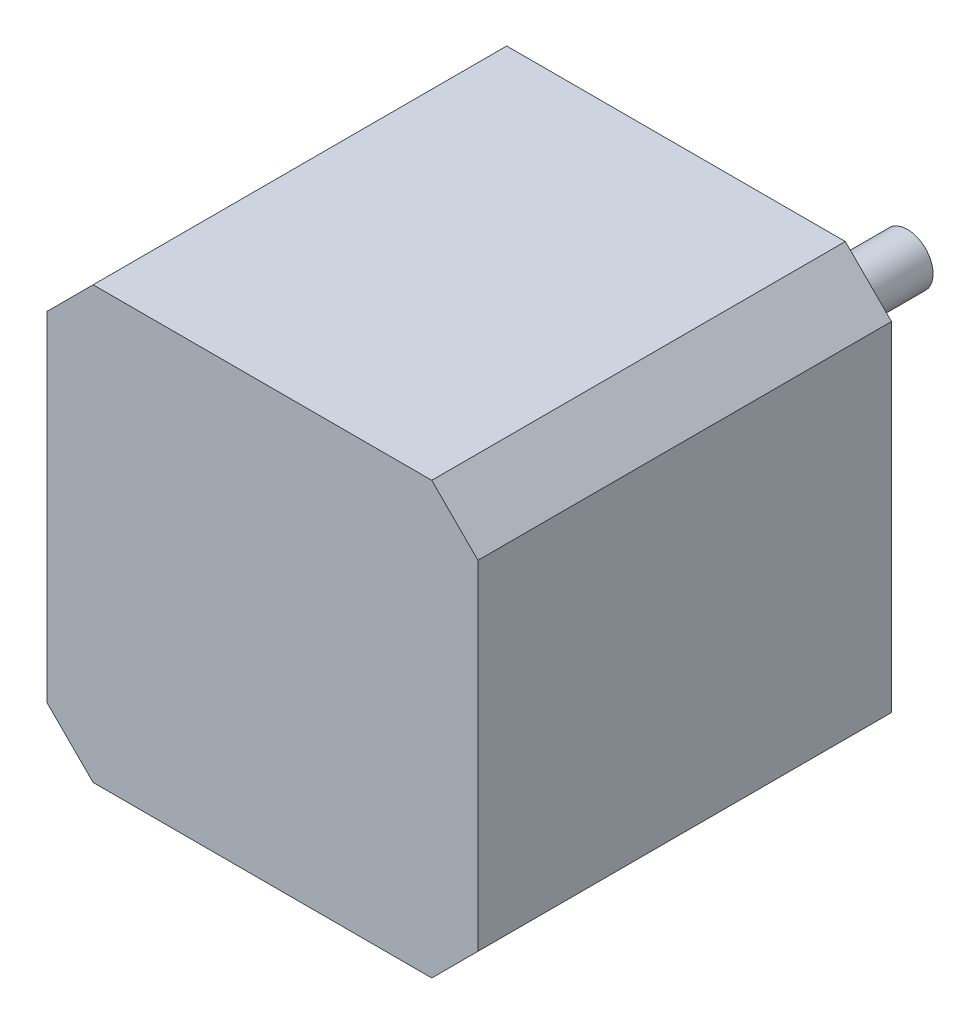
from build123d import *

# Parameters (mm, degrees)
SKETCH1_W           = 42
SKETCH1_H           = 42
BOSS_EXTRUDE1_DEPTH = 40.3
SKETCH1_3_R         = 1.5
CUT_EXTRUDE1_DEPTH  = 5
SKETCH1_4_R         = 11
BOSS_EXTRUDE2_DEPTH = 1.8
CHAMFER1_SIZE       = 4.5
SKETCH2_R           = 2.5
BOSS_EXTRUDE3_DEPTH = 20.75


with BuildPart() as part:
    # Sketch1 → Boss-Extrude1 (new body)
    with BuildSketch(Plane.XY):
        Rectangle(SKETCH1_W, SKETCH1_H)
    extrude(amount=BOSS_EXTRUDE1_DEPTH)

    # Sketch1<3> → Cut-Extrude1 (cut)
    with BuildSketch(Plane.XY):
        with Locations((15.5, 15.5)):
            Circle(SKETCH1_3_R)
        with Locations((15.5, -15.5)):
            Circle(SKETCH1_3_R)
        with Locations((-15.5, -15.5)):
            Circle(SKETCH1_3_R)
        with Locations((-15.5, 15.5)):
            Circle(SKETCH1_3_R)
    extrude(amount=CUT_EXTRUDE1_DEPTH, mode=Mode.SUBTRACT)

    # Sketch1<4> → Boss-Extrude2 (add)
    with BuildSketch(Plane.XY):
        Circle(SKETCH1_4_R)
    extrude(amount=-BOSS_EXTRUDE2_DEPTH)

    # Chamfer1
    chamfer1_edges = [part.edges().sort_by_distance(p)[0] for p in [
        (21, 21, 20.15),
        (21, -21, 20.15),
        (-21, -21, 20.15),
        (-21, 21, 20.15),
    ]]
    chamfer(chamfer1_edges, length=CHAMFER1_SIZE)

    # Sketch2 → Boss-Extrude3 (add)
    with BuildSketch(Plane(origin=(0, 0, -1.8), x_dir=(-1, 0, 0), z_dir=(0, 0, -1))):
        Circle(SKETCH2_R)
    extrude(amount=BOSS_EXTRUDE3_DEPTH)


solid = part.part
